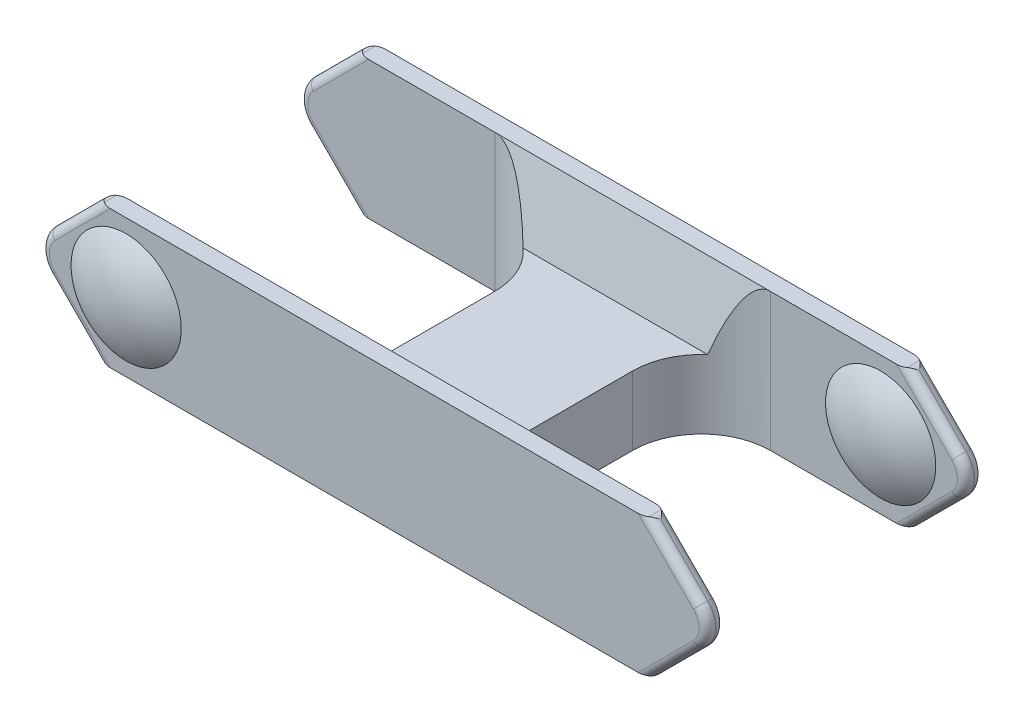
from build123d import *

# Parameters (mm, degrees)
BOSS_EXTRUDE1_DEPTH = 12.7
CUT_EXTRUDE2_DEPTH  = 66.991135768
CUT_EXTRUDE1_DEPTH  = 43.597094971
FILLET1_R           = 0.762


with BuildPart() as part:
    # Sketch1 → Boss-Extrude1 (new body)
    with BuildSketch(Plane(origin=(0, 0, 0), x_dir=(1, 0, 0), z_dir=(0, 1, 0))):
        with BuildLine():
            Line((-31.75, -12.7), (31.75, -12.7))
            Line((31.75, -12.7), (31.75, -11.1125))
            Line((31.75, -11.1125), (12.7, -11.1125))
            ThreePointArc((12.7, -11.1125), (8.209871939, -9.252628061), (6.35, -4.7625))
            Line((6.35, -4.7625), (6.35, 4.7625))
            ThreePointArc((6.35, 4.7625), (8.209871939, 9.252628061), (12.7, 11.1125))
            Line((12.7, 11.1125), (31.75, 11.1125))
            Line((31.75, 11.1125), (31.75, 12.7))
            Line((31.75, 12.7), (-31.75, 12.7))
            Line((-31.75, 12.7), (-31.75, 11.1125))
            Line((-31.75, 11.1125), (-12.7, 11.1125))
            ThreePointArc((-12.7, 11.1125), (-8.209871939, 9.252628061), (-6.35, 4.7625))
            Line((-6.35, 4.7625), (-6.35, -4.7625))
            ThreePointArc((-6.35, -4.7625), (-8.209871939, -9.252628061), (-12.7, -11.1125))
            Line((-12.7, -11.1125), (-31.75, -11.1125))
            Line((-31.75, -11.1125), (-31.75, -12.7))
        make_face()
    extrude(amount=BOSS_EXTRUDE1_DEPTH)

    # Sketch3 → Cut-Extrude2 (cut, through all)
    with BuildSketch(Plane.ZY.offset(31.75)):
        Polygon((11.1125, 12.7), (4.7625, 12.7), (-4.7625, 12.7), (-11.1125, 12.7), (-9.525, 6.35), (9.525, 6.35), align=None)
    extrude(amount=-CUT_EXTRUDE2_DEPTH, mode=Mode.SUBTRACT)

    # Sketch2 → Cut-Extrude1 (cut, through all)
    with BuildSketch(Plane.XY.offset(12.7)):
        with BuildLine():
            ThreePointArc((-29.953948776, 4.553948776), (-30.697897552, 6.35), (-29.953948776, 8.146051224))
            Line((-29.953948776, 8.146051224), (-25.4, 12.7))
            Line((-25.4, 12.7), (-31.75, 12.7))
            Line((-31.75, 12.7), (-31.75, 0))
            Line((-31.75, 0), (-25.4, 0))
            Line((-25.4, 0), (-29.953948776, 4.553948776))
        make_face()
        with BuildLine():
            Line((31.75, 12.7), (25.4, 12.7))
            Line((25.4, 12.7), (29.953948776, 8.146051224))
            ThreePointArc((29.953948776, 8.146051224), (30.697897552, 6.35), (29.953948776, 4.553948776))
            Line((29.953948776, 4.553948776), (25.4, 0))
            Line((25.4, 0), (31.75, 0))
            Line((31.75, 0), (31.75, 12.7))
        make_face()
    extrude(amount=-CUT_EXTRUDE1_DEPTH, mode=Mode.SUBTRACT)

    # Sketch4 → Revolve1 (revolve)
    with BuildSketch(Plane.ZY.offset(22.86), mode=Mode.PRIVATE) as revolve1_sk:
        with BuildLine():
            Line((12.7, 6.35), (12.7, 11.43))
            ThreePointArc((12.7, 11.43), (13.881381744, 9.01113492), (14.2875, 6.35))
            Line((14.2875, 6.35), (12.7, 6.35))
        make_face()
    revolve1 = revolve(revolve1_sk.sketch.rotate(Axis((-22.86, 6.35, 0), (0, 0, 1)), 180), axis=Axis((-22.86, 6.35, 0), (0, 0, 1)))

    # Mirror1: Revolve1 across plane
    add(revolve1.mirror(Plane.XY))

    # Sketch5 → Revolve2 (revolve)
    with BuildSketch(Plane(origin=(22.86, 0, 0), x_dir=(0, 0, -1), z_dir=(1, 0, 0))):
        with BuildLine():
            Line((11.1125, 6.35), (11.1125, 11.43))
            ThreePointArc((11.1125, 11.43), (9.931118256, 9.01113492), (9.525, 6.35))
            Line((9.525, 6.35), (11.1125, 6.35))
        make_face()
    revolve2 = revolve(axis=Axis((22.86, 6.35, -9.525), (0, 0, 1)))

    # Mirror2: Revolve2 across plane
    add(revolve2.mirror(Plane.XY))

    # Fillet1
    fillet1_edges = [part.edges().sort_by_distance(p)[0] for p in [
        (-27.676974388, 10.423025612, 11.1125),
        (-25.4, 12.7, 11.90625),
        (-27.676974388, 2.276974388, 12.7),
        (-30.697897552, 6.35, -11.1125),
        (-30.697897552, 6.35, 11.1125),
        (-27.676974388, 2.276974388, -11.1125),
        (-27.676974388, 2.276974388, 11.1125),
        (-30.697897552, 6.35, -12.7),
        (-27.676974388, 2.276974388, -12.7),
        (-27.676974388, 10.423025612, 12.7),
        (30.697897552, 6.35, 12.7),
        (25.4, 12.7, 11.90625),
        (25.4, 12.7, -11.90625),
        (27.676974388, 10.423025612, 12.7),
        (27.676974388, 2.276974388, 11.1125),
        (27.676974388, 2.276974388, -11.1125),
        (27.676974388, 2.276974388, -12.7),
        (30.697897552, 6.35, 11.1125),
        (27.676974388, 10.423025612, 11.1125),
        (27.676974388, 10.423025612, -11.1125),
        (30.697897552, 6.35, -12.7),
        (27.676974388, 10.423025612, -12.7),
        (27.676974388, 2.276974388, 12.7),
        (30.697897552, 6.35, -11.1125),
        (-30.697897552, 6.35, 12.7),
        (-25.4, 12.7, -11.90625),
        (-27.676974388, 10.423025612, -11.1125),
        (-27.676974388, 10.423025612, -12.7),
    ]]
    fillet(fillet1_edges, radius=FILLET1_R)


solid = part.part
